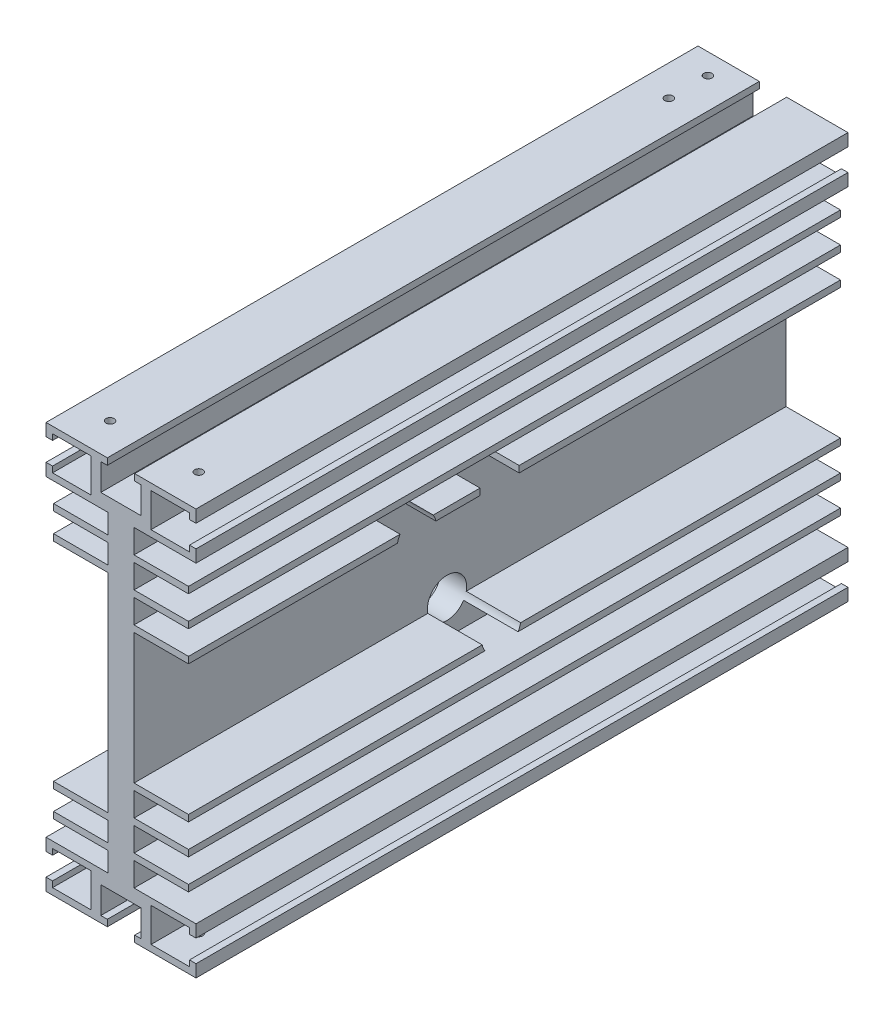
from build123d import *

# Parameters (mm, degrees)
RESSALTO_EXTRUS_O1_DEPTH                     = 200
CORTE_EXTRUS_O3_REACH                        = 224.463
ESBO_O4_R                                    = 1.825
CORTE_EXTRUS_O5_REACH                        = 224.463
ESBO_O6_R                                    = 6.0125
BROCA_DE_ROSQUEAR_PARA_TARRAXA_DE_M3X0_5_D   = 2.5
ESBO_O15_W                                   = 12
ESBO_O15_H                                   = 2.152025528
CORTE_EXTRUS_O7_DEPTH                        = 16.7
CORTE_EXTRUS_O8_REACH                        = 224.463
ESBO_O5_R                                    = 6.0125
BROCA_DE_ROSQUEAR_PARA_TARRAXA_DE_M3_2_D     = 2.5
BROCA_DE_ROSQUEAR_PARA_TARRAXA_DE_M3_2_DEPTH = 2
BROCA_DE_ROSQUEAR_PARA_TARRAXA_DE_M3_3_D     = 2.5
BROCA_DE_ROSQUEAR_PARA_TARRAXA_DE_M3_3_DEPTH = 2
BROCA_DE_ROSQUEAR_PARA_TARRAXA_DE_M3_4_D     = 2.5
BROCA_DE_ROSQUEAR_PARA_TARRAXA_DE_M3_4_DEPTH = 2
BROCA_DE_ROSQUEAR_PARA_TARRAXA_DE_M3_5_D     = 2.5
BROCA_DE_ROSQUEAR_PARA_TARRAXA_DE_M3_5_DEPTH = 2


with BuildPart() as part:
    # Esboço1 → Ressalto-extrusão1 (new body)
    with BuildSketch(Plane.XY):
        Polygon((-54.740307174, -0.6), (-54.740307174, 63.2), (-71.440307174, 63.2), (-71.440307174, 65.2), (-54.740307174, 65.2), (-54.740307174, 71.2), (-71.440307174, 71.2), (-71.440307174, 73.2), (-54.740307174, 73.2), (-54.740307174, 79.2), (-73.740307174, 79.2), (-73.740307174, 83), (-71.740307174, 83), (-71.740307174, 81.2), (-59.940307174, 81.2), (-59.940307174, 91.6), (-71.740307174, 91.6), (-71.740307174, 89.8), (-73.740307174, 89.8), (-73.740307174, 93.6), (-54.940307174, 93.6), (-54.940307174, 91.6), (-56.940307174, 91.6), (-56.940307174, 83.4), (-44.540307174, 83.4), (-44.540307174, 91.6), (-46.540307174, 91.6), (-46.540307174, 93.6), (-27.740307174, 93.6), (-27.740307174, 89.8), (-29.740307174, 89.8), (-29.740307174, 91.6), (-41.540307174, 91.6), (-41.540307174, 81.2), (-29.740307174, 81.2), (-29.740307174, 83), (-27.740307174, 83), (-27.740307174, 79.2), (-46.740307174, 79.2), (-46.740307174, 71.9), (-30.040307174, 71.9), (-30.040307174, 69.9), (-46.740307174, 69.9), (-46.740307174, 62.6), (-30.040307174, 62.6), (-30.040307174, 60.6), (-46.740307174, 60.6), (-46.740307174, 53.3), (-30.040307174, 53.3), (-30.040307174, 51.3), (-46.740307174, 51.3), (-46.740307174, 11.3), (-30.040307174, 11.3), (-30.040307174, 9.3), (-46.740307174, 9.3), (-46.740307174, 2), (-30.040307174, 2), (-30.040307174, 0), (-46.740307174, 0), (-46.740307174, -7.3), (-30.040307174, -7.3), (-30.040307174, -9.3), (-46.740307174, -9.3), (-46.740307174, -16.6), (-27.740307174, -16.6), (-27.740307174, -20.4), (-29.740307174, -20.4), (-29.740307174, -18.6), (-41.540307174, -18.6), (-41.540307174, -29), (-29.740307174, -29), (-29.740307174, -27.2), (-27.740307174, -27.2), (-27.740307174, -31), (-46.540307174, -31), (-46.540307174, -29), (-44.540307174, -29), (-44.540307174, -20.8), (-56.940307174, -20.8), (-56.940307174, -29), (-54.940307174, -29), (-54.940307174, -31), (-73.740307174, -31), (-73.740307174, -27.2), (-71.740307174, -27.2), (-71.740307174, -29), (-59.940307174, -29), (-59.940307174, -18.6), (-71.740307174, -18.6), (-71.740307174, -20.4), (-73.740307174, -20.4), (-73.740307174, -16.6), (-54.740307174, -16.6), (-54.740307174, -10.6), (-71.440307174, -10.6), (-71.440307174, -8.6), (-54.740307174, -8.6), (-54.740307174, -2.6), (-71.440307174, -2.6), (-71.440307174, -0.6), align=None)
    extrude(amount=RESSALTO_EXTRUS_O1_DEPTH)

    # Esboço4 → Corte-extrusão3 (cut, up to next)
    with BuildSketch(Plane.ZY.offset(54.740307174), mode=Mode.PRIVATE) as corte_extrus_o3_sk1:
        with Locations(Location((104, 50.1, 0), (0, 0, 270))):
            Circle(ESBO_O4_R)
    corte_extrus_o3_tool1 = extrude(corte_extrus_o3_sk1.sketch, amount=-CORTE_EXTRUS_O3_REACH, mode=Mode.PRIVATE) & part.part
    add(corte_extrus_o3_tool1.solids().sort_by_distance((-54.740307, 50.1, 104))[0], mode=Mode.SUBTRACT)

    # Esboço6 → Corte-extrusão5 (cut, up to next)
    with BuildSketch(Plane.ZY.offset(54.740307174), mode=Mode.PRIVATE) as corte_extrus_o5_sk1:
        with Locations(Location((104, 12.5, 0), (0, 0, 270))):
            Circle(ESBO_O6_R)
    corte_extrus_o5_tool1 = extrude(corte_extrus_o5_sk1.sketch, amount=-CORTE_EXTRUS_O5_REACH, mode=Mode.PRIVATE) & part.part
    add(corte_extrus_o5_tool1.solids().sort_by_distance((-54.740307, 12.5, 104))[0], mode=Mode.SUBTRACT)

    # Broca de rosquear para tarraxa de M3x0.5 (through all)
    with Locations(Plane.ZY.offset(54.740307174)):
        with Locations((6, 5.9), (6, 58.2)):
            Hole(BROCA_DE_ROSQUEAR_PARA_TARRAXA_DE_M3X0_5_D / 2)

    # Esboço15 → Corte-extrusão7 (cut)
    with BuildSketch(Plane(origin=(-30.040307174, 0, 0), x_dir=(0, 0, -1), z_dir=(1, 0, 0))):
        with Locations((-104.566575702, 52.223987236)):
            Rectangle(ESBO_O15_W, ESBO_O15_H)
    extrude(amount=-CORTE_EXTRUS_O7_DEPTH, mode=Mode.SUBTRACT)

    # Esboço5 → Corte-extrusão8 (cut, up to next)
    with BuildSketch(Plane.ZY.offset(54.740307174), mode=Mode.PRIVATE) as corte_extrus_o8_sk1:
        with Locations(Location((130, 50.1, 0), (0, 0, 270))):
            Circle(ESBO_O5_R)
    corte_extrus_o8_tool1 = extrude(corte_extrus_o8_sk1.sketch, amount=-CORTE_EXTRUS_O8_REACH, mode=Mode.PRIVATE) & part.part
    add(corte_extrus_o8_tool1.solids().sort_by_distance((-54.740307, 50.1, 130))[0], mode=Mode.SUBTRACT)

    # Broca de rosquear para tarraxa de M3 2
    with Locations(Plane.XZ.offset(31)):
        with Locations((-64.286083069, 189.76), (-37.140307173, 189.76)):
            Hole(BROCA_DE_ROSQUEAR_PARA_TARRAXA_DE_M3_2_D / 2, depth=BROCA_DE_ROSQUEAR_PARA_TARRAXA_DE_M3_2_DEPTH)

    # Broca de rosquear para tarraxa de M3 3
    with Locations(Plane(origin=(0, 93.6, 0), x_dir=(-1, 0, 0), z_dir=(0, 1, 0))):
        with Locations((37.140307173, 189.76), (64.340307173, 189.76)):
            Hole(BROCA_DE_ROSQUEAR_PARA_TARRAXA_DE_M3_3_D / 2, depth=BROCA_DE_ROSQUEAR_PARA_TARRAXA_DE_M3_3_DEPTH)

    # Broca de rosquear para tarraxa de M3 4
    with Locations(Plane.XZ.offset(31)):
        with Locations((-64.340307174, 18.36), (-64.340307174, 6.36)):
            Hole(BROCA_DE_ROSQUEAR_PARA_TARRAXA_DE_M3_4_D / 2, depth=BROCA_DE_ROSQUEAR_PARA_TARRAXA_DE_M3_4_DEPTH)

    # Broca de rosquear para tarraxa de M3 5
    with Locations(Plane(origin=(0, 93.6, 0), x_dir=(-1, 0, 0), z_dir=(0, 1, 0))):
        with Locations((64.340307174, 18.36), (64.340307174, 6.36)):
            Hole(BROCA_DE_ROSQUEAR_PARA_TARRAXA_DE_M3_5_D / 2, depth=BROCA_DE_ROSQUEAR_PARA_TARRAXA_DE_M3_5_DEPTH)


solid = part.part
